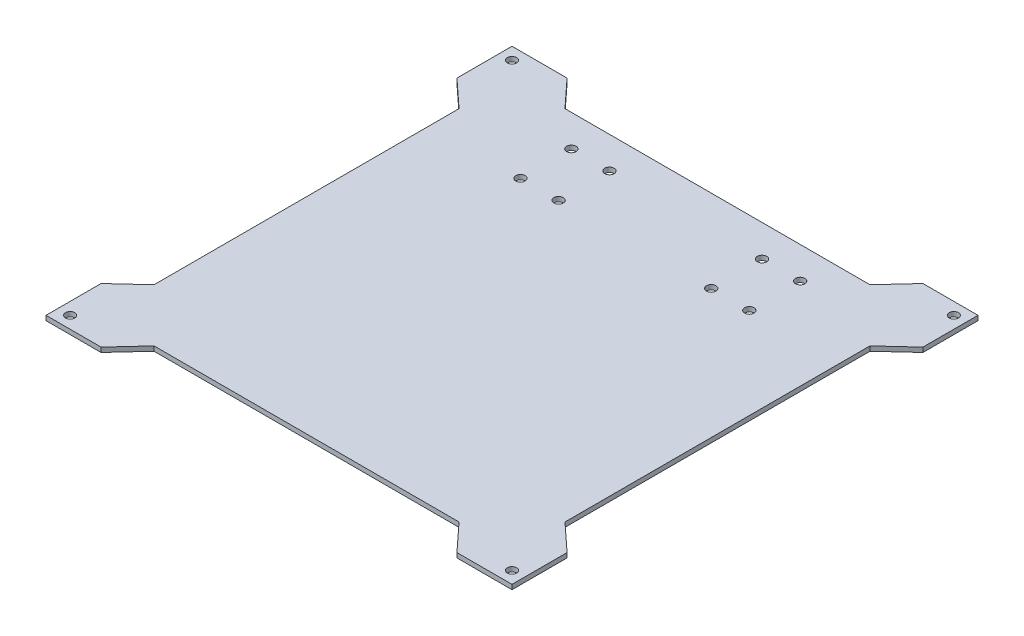
from build123d import *

# Parameters (mm, degrees)
SKETCH1_R           = 2.2
BOSS_EXTRUDE1_DEPTH = 2.2
SKETCH2_R           = 2.225
CUT_EXTRUDE1_DEPTH  = 235.422353883


with BuildPart() as part:
    # Sketch1 → Boss-Extrude1 (new body)
    with BuildSketch(Plane(origin=(0, 0, 0), x_dir=(1, 0, 0), z_dir=(0, 1, 0))):
        Polygon((84, 207), (72, 194), (0, 194), (-72, 194), (-84, 207), (-110, 207), (-110, 181), (-97, 169), (-97, 97), (-97, 25), (-110, 13), (-110, -13), (-84, -13), (-72, 0), (0, 0), (72, 0), (84, -13), (110, -13), (110, 13), (97, 25), (97, 97), (97, 169), (110, 181), (110, 207), align=None)
        with Locations(Location((104.3, 201.3, 0), (0, 0, 270))):
            Circle(SKETCH1_R, mode=Mode.SUBTRACT)
        with Locations(Location((-104.3, 201.3, 0), (0, 0, 270))):
            Circle(SKETCH1_R, mode=Mode.SUBTRACT)
        with Locations(Location((-104.3, -7.3, 0), (0, 0, 270))):
            Circle(SKETCH1_R, mode=Mode.SUBTRACT)
        with Locations(Location((104.3, -7.3, 0), (0, 0, 270))):
            Circle(SKETCH1_R, mode=Mode.SUBTRACT)
    extrude(amount=BOSS_EXTRUDE1_DEPTH)

    # Sketch2 → Cut-Extrude1 (cut, through all)
    with BuildSketch(Plane(origin=(0, 2.2, 0), x_dir=(1, 0, 0), z_dir=(0, 1, 0))):
        with Locations(Location((-54.025, 179.025, 0), (0, 0, 270))):
            Circle(SKETCH2_R)
        with Locations(Location((-36.025, 179.025, 0), (0, 0, 270))):
            Circle(SKETCH2_R)
        with Locations(Location((-54.025, 155.025, 0), (0, 0, 270))):
            Circle(SKETCH2_R)
        with Locations(Location((-36.025, 155.025, 0), (0, 0, 270))):
            Circle(SKETCH2_R)
        with Locations(Location((36.025, 155.025, 0), (0, 0, 90))):
            Circle(SKETCH2_R)
        with Locations(Location((54.025, 155.025, 0), (0, 0, 90))):
            Circle(SKETCH2_R)
        with Locations(Location((36.025, 179.025, 0), (0, 0, 90))):
            Circle(SKETCH2_R)
        with Locations(Location((54.025, 179.025, 0), (0, 0, 90))):
            Circle(SKETCH2_R)
    extrude(amount=-CUT_EXTRUDE1_DEPTH, mode=Mode.SUBTRACT)


solid = part.part
